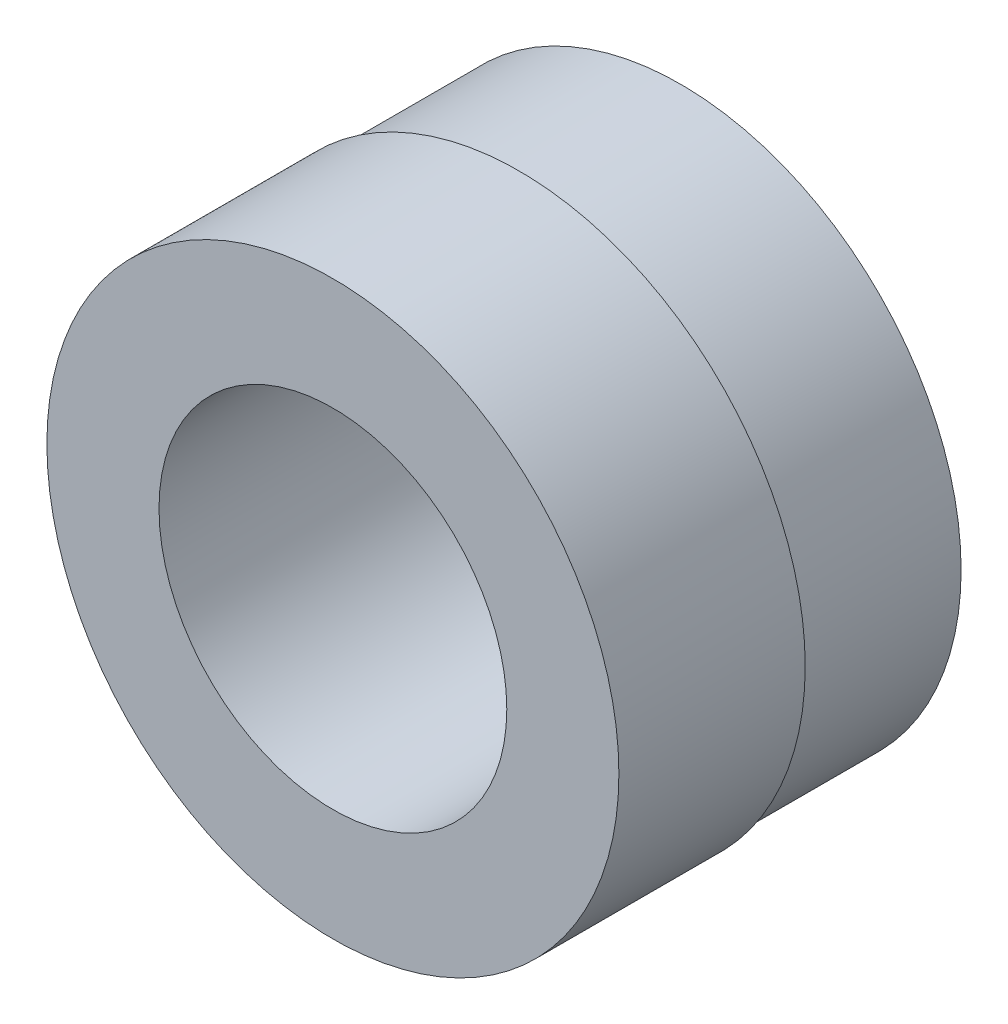
from build123d import *

# Parameters (mm, degrees)
SKETCH1_W                = 23.025
SKETCH1_H                = 15
SKETCH2_R                = 22.575
BOSS_EXTRUDE1_DEPTH      = 13
HOLE1_D                  = 20
HOLE1_CBORE_D            = 28
HOLE1_CBORE_DEPTH        = 27
M2_CLEARANCE_HOLE1_D     = 2.459
M2_CLEARANCE_HOLE1_DEPTH = 14.999999999
M2_CLEARANCE_HOLE1_TIP   = 0.738758131


with BuildPart() as part:
    # Sketch1 → Revolve1 (revolve)
    with BuildSketch(Plane(origin=(0, 0, 0), x_dir=(1, 0, 0), z_dir=(0, 1, 0))):
        with Locations((11.5125, -20.5)):
            Rectangle(SKETCH1_W, SKETCH1_H)
    revolve(axis=Axis((0, 0, 13), (0, 0, 1)))

    # Sketch2 → Boss-Extrude1 (add)
    with BuildSketch(Plane(origin=(0, 0, 13), x_dir=(-1, 0, 0), z_dir=(0, 0, -1))):
        with Locations(Location((0, 0, 0), (0, 0, 180))):
            Circle(SKETCH2_R)
    extrude(amount=BOSS_EXTRUDE1_DEPTH)

    # Hole1 (through all)
    with Locations(Plane.XY.offset(28)):
        with Locations((0, 0)):
            CounterBoreHole(HOLE1_D / 2, HOLE1_CBORE_D / 2, HOLE1_CBORE_DEPTH)

    # M2 Clearance Hole1
    with Locations(Plane(origin=(0, 0, 0), x_dir=(-1, 0, 0), z_dir=(0, 0, -1))):
        with Locations((0, 17.5), (-17.5, 0), (0, -17.5), (17.5, 0)):
            Hole(M2_CLEARANCE_HOLE1_D / 2, depth=M2_CLEARANCE_HOLE1_DEPTH)
            with Locations((0, 0, -(M2_CLEARANCE_HOLE1_DEPTH + M2_CLEARANCE_HOLE1_TIP / 2))):  # 118° drill point
                Cone(0, M2_CLEARANCE_HOLE1_D / 2, M2_CLEARANCE_HOLE1_TIP, mode=Mode.SUBTRACT)


solid = part.part
